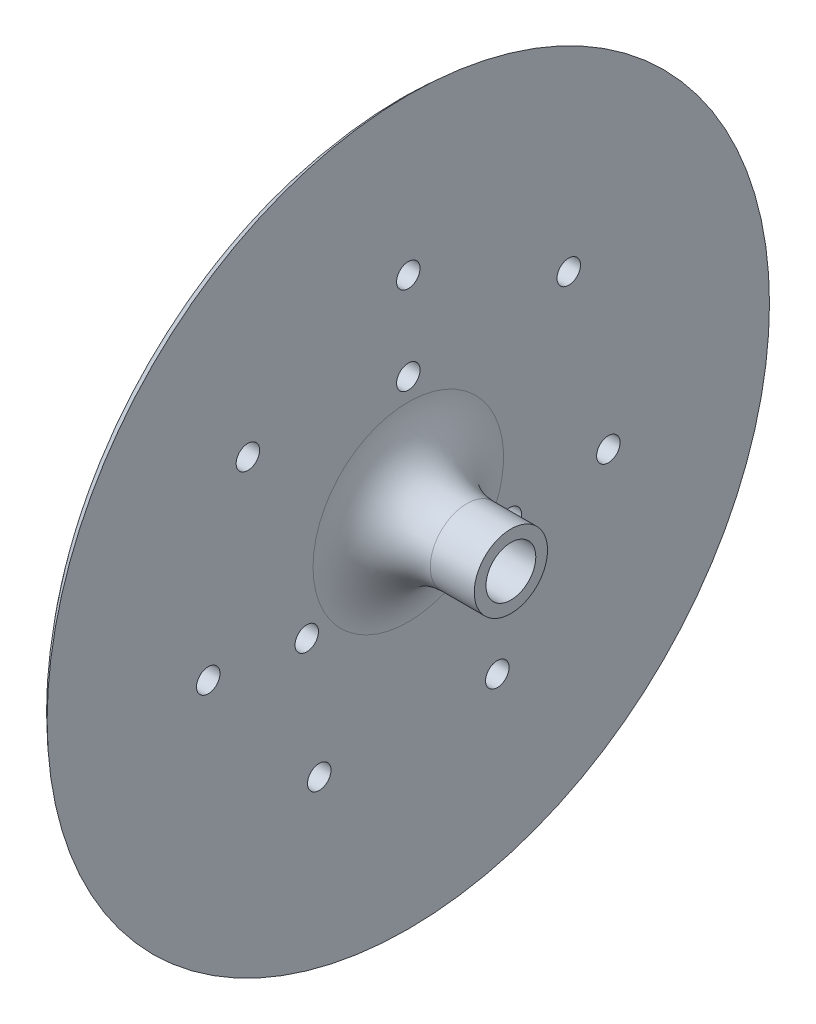
from build123d import *

# Parameters (mm, degrees)
CUT_EXTRUDE_1_DEPTH      = 35
CUT_EXTRUDE_3_DEPTH      = 5
SKETCH_5_R               = 5
CUT_EXTRUDE_4_DEPTH      = 25
SKETCH_6_R               = 4
CUT_EXTRUDE_5_DEPTH      = 178.734491343
PATTERN_CIRCULAR_1_COUNT = 7
SKETCH_7_R               = 4
CUT_EXTRUDE_6_DEPTH      = 178.734491343
PATTERN_CIRCULAR_2_COUNT = 3


with BuildPart() as part:
    # 草图1 → 旋转1 (revolve)
    with BuildSketch(Plane.XY):
        with BuildLine():
            Line((0, 0), (50, 0))
            Line((50, 0), (50, 12.5))
            Line((50, 12.5), (35, 12.5))
            ThreePointArc((35, 12.5), (20.857864376, 18.357864376), (15, 32.5))
            Line((15, 32.5), (15, 123.216373532))
            ThreePointArc((15, 123.216373532), (6.889116577, 112.845232579), (4, 100))
            Line((4, 100), (4, 50))
            Line((4, 50), (0, 50))
            Line((0, 50), (0, 0))
        make_face()
    revolve(axis=Axis((0, 0, 0), (1, 0, 0)))

    # 草图3 → 切除-拉伸1 (cut)
    with BuildSketch(Plane(origin=(50, 0, 0), x_dir=(0, 0, -1), z_dir=(1, 0, 0))):
        with BuildLine():
            Line((-3, 6), (-3, 7.95298686))
            ThreePointArc((-3, 7.95298686), (-4.834769901, -6.991065727), (8.5, 0))
            ThreePointArc((8.5, 0), (6.991065727, 4.834769901), (3, 7.95298686))
            Line((3, 7.95298686), (3, 6))
            Line((3, 6), (-3, 6))
        make_face()
    extrude(amount=-CUT_EXTRUDE_1_DEPTH, mode=Mode.SUBTRACT)

    # 草图3<4> → 切除-拉伸3 (cut)
    with BuildSketch(Plane(origin=(50, 0, 0), x_dir=(0, 0, -1), z_dir=(1, 0, 0))):
        with BuildLine():
            Line((-3, 7.95298686), (-3, 6))
            Line((-3, 6), (3, 6))
            Line((3, 6), (3, 7.95298686))
            ThreePointArc((3, 7.95298686), (0, 8.5), (-3, 7.95298686))
        make_face()
    extrude(amount=-CUT_EXTRUDE_3_DEPTH, mode=Mode.SUBTRACT)

    # 草图5 → 切除-拉伸4 (cut)
    with BuildSketch(Plane.ZY):
        Circle(SKETCH_5_R)
    extrude(amount=-CUT_EXTRUDE_4_DEPTH, mode=Mode.SUBTRACT)

    # 草图6 → 切除-拉伸5 (cut, symmetric)
    with BuildSketch(Plane(origin=(15, 0, 0), x_dir=(0, 0, -1), z_dir=(1, 0, 0))):
        with Locations((0, 70)):
            Circle(SKETCH_6_R)
    cut_extrude_5 = extrude(amount=CUT_EXTRUDE_5_DEPTH, both=True, mode=Mode.SUBTRACT)

    # 阵列(圆周)1: 切除-拉伸5 ×7 about axis
    pattern_circular_1_axis = Axis((35, 0, 0), (-1, 0, 0))
    for i in range(1, PATTERN_CIRCULAR_1_COUNT):
        add(cut_extrude_5.rotate(pattern_circular_1_axis, i * 360 / PATTERN_CIRCULAR_1_COUNT), mode=Mode.SUBTRACT)

    # 草图7 → 切除-拉伸6 (cut, symmetric)
    with BuildSketch(Plane(origin=(15, 0, 0), x_dir=(0, 0, -1), z_dir=(1, 0, 0))):
        with Locations((0, 40)):
            Circle(SKETCH_7_R)
    cut_extrude_6 = extrude(amount=CUT_EXTRUDE_6_DEPTH, both=True, mode=Mode.SUBTRACT)

    # 阵列(圆周)2: 切除-拉伸6 ×3 about axis
    pattern_circular_2_axis = Axis((50, 0, 0), (1, 0, 0))
    for i in range(1, PATTERN_CIRCULAR_2_COUNT):
        add(cut_extrude_6.rotate(pattern_circular_2_axis, i * 360 / PATTERN_CIRCULAR_2_COUNT), mode=Mode.SUBTRACT)


solid = part.part
